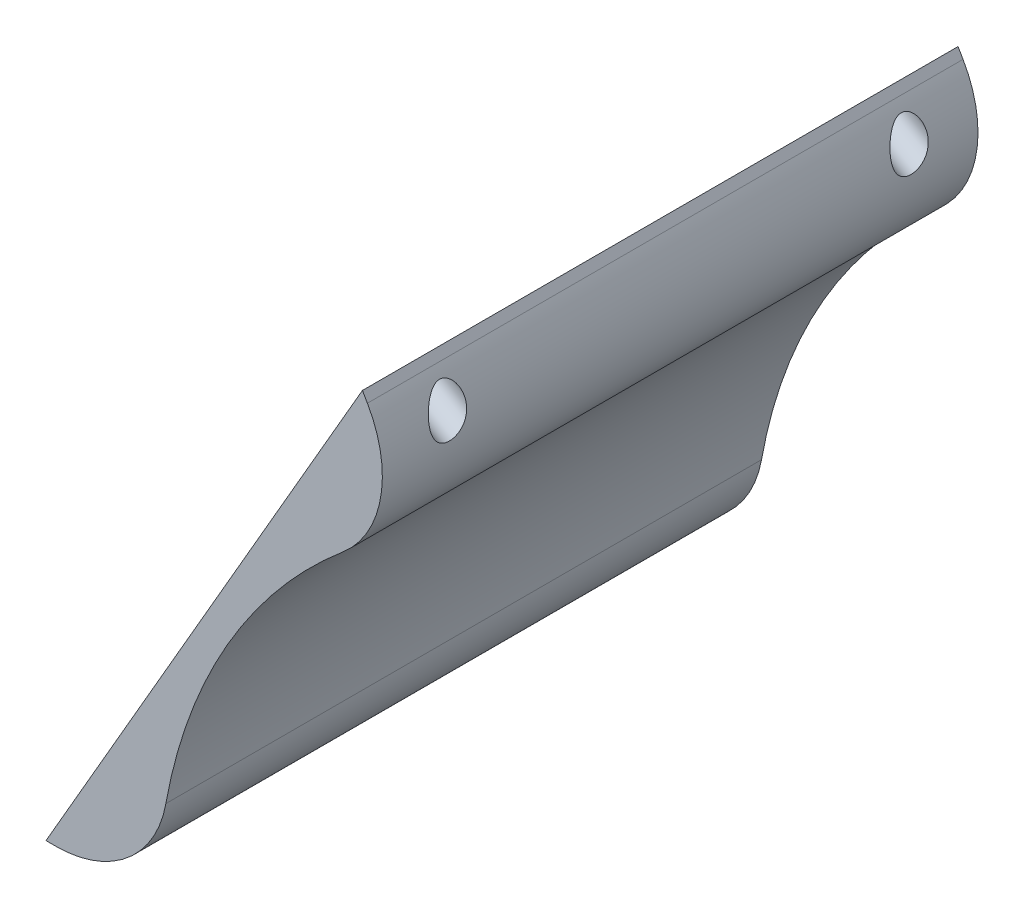
from build123d import *

# Parameters (mm, degrees)
BOSS_EXTRUDE1_DEPTH       = 80
FILLET1_R                 = 15
FILLET2_R                 = 15
SKETCH3_R                 = 2.5
CUT_EXTRUDE1_DEPTH        = 10
SKETCH3_2_R               = 2.5
BOSS_EXTRUDE2_DEPTH       = 1
SKETCH5_R                 = 1.5
CUT_EXTRUDE2_DEPTH        = 1
LPATTERN1_COUNT           = 2
LPATTERN1_PITCH           = 62
LPATTERN2_COUNT           = 2
LPATTERN2_PITCH           = 77
LPATTERN2_COPY_1_SKETCH_R = 2.5
LPATTERN2_COPY_1_DEPTH    = 10
LPATTERN2_COPY_2_SKETCH_R = 2.5
LPATTERN2_COPY_2_DEPTH    = 1
LPATTERN2_COPY_3_SKETCH_R = 1.5
LPATTERN2_COPY_3_DEPTH    = 1


with BuildPart() as part:
    # Sketch2 → Boss-Extrude1 (new body)
    with BuildSketch(Plane.XY):
        with BuildLine():
            Line((-70, 0), (-85, 0))
            Line((-85, 0), (-42.5, 73.612159322))
            Line((-42.5, 73.612159322), (-35, 60.621778265))
            ThreePointArc((-35, 60.621778265), (-60.621778265, 35), (-70, 0))
        make_face()
    extrude(amount=BOSS_EXTRUDE1_DEPTH)

    # Fillet1
    fillet1_edges = [part.edges().sort_by_distance(p)[0] for p in [
        (-70, 0, 40),
    ]]
    fillet(fillet1_edges, radius=FILLET1_R)

    # Fillet2
    fillet2_edges = [part.edges().sort_by_distance(p)[0] for p in [
        (-35, 60.621778265, 40),
    ]]
    fillet(fillet2_edges, radius=FILLET2_R)

    # Sketch3 → Cut-Extrude1 (cut)
    with BuildSketch(Plane(origin=(-63.75, 36.806079661, 0), x_dir=(0, 0, 1), z_dir=(-0.866025403784438, 0.5000000000000011, 0))):
        with Locations((9, 38.5)):
            Circle(SKETCH3_R)
    cut_extrude1 = extrude(amount=-CUT_EXTRUDE1_DEPTH, mode=Mode.SUBTRACT)

    # Sketch3<2> → Boss-Extrude2 (add)
    with BuildSketch(Plane(origin=(-63.75, 36.806079661, 0), x_dir=(0, 0, 1), z_dir=(-0.866025403784438, 0.5000000000000011, 0))):
        with Locations((9, 38.5)):
            Circle(SKETCH3_2_R)
    boss_extrude2 = extrude(amount=-BOSS_EXTRUDE2_DEPTH)

    # Sketch5 → Cut-Extrude2 (cut)
    with BuildSketch(Plane(origin=(-63.75, 36.806079661, 0), x_dir=(0, 0, 1), z_dir=(-0.866025403784438, 0.5000000000000011, 0))):
        with Locations((9, 38.5)):
            Circle(SKETCH5_R)
    cut_extrude2 = extrude(amount=-CUT_EXTRUDE2_DEPTH, mode=Mode.SUBTRACT)

    # LPattern1: Cut-Extrude1, Boss-Extrude2, Cut-Extrude2 ×2
    with Locations(*[(0, 0, i * LPATTERN1_PITCH) for i in range(1, LPATTERN1_COUNT)]):
        add(cut_extrude1, mode=Mode.SUBTRACT)
        add(boss_extrude2)
        add(cut_extrude2, mode=Mode.SUBTRACT)

    # LPattern2: Cut-Extrude1, Boss-Extrude2, Cut-Extrude2 ×2
    with Locations(*[Vector(-0.500000000000001, -0.866025403784438, 0) * (i * LPATTERN2_PITCH) for i in range(1, LPATTERN2_COUNT)]):
        add(cut_extrude1, mode=Mode.SUBTRACT)
        add(boss_extrude2)
        add(cut_extrude2, mode=Mode.SUBTRACT)

    # LPattern2 copy 1 sketch → LPattern2 copy 1 (cut)
    with BuildSketch(Plane(origin=(-102.25, -29.877876431, 62), x_dir=(0, 0, 1), z_dir=(-0.866025403784438, 0.5000000000000011, 0))):
        with Locations((9, 38.5)):
            Circle(LPATTERN2_COPY_1_SKETCH_R)
    extrude(amount=-LPATTERN2_COPY_1_DEPTH, mode=Mode.SUBTRACT)

    # LPattern2 copy 2 sketch → LPattern2 copy 2 (add)
    with BuildSketch(Plane(origin=(-102.25, -29.877876431, 62), x_dir=(0, 0, 1), z_dir=(-0.866025403784438, 0.5000000000000011, 0))):
        with Locations((9, 38.5)):
            Circle(LPATTERN2_COPY_2_SKETCH_R)
    extrude(amount=-LPATTERN2_COPY_2_DEPTH)

    # LPattern2 copy 3 sketch → LPattern2 copy 3 (cut)
    with BuildSketch(Plane(origin=(-102.25, -29.877876431, 62), x_dir=(0, 0, 1), z_dir=(-0.866025403784438, 0.5000000000000011, 0))):
        with Locations((9, 38.5)):
            Circle(LPATTERN2_COPY_3_SKETCH_R)
    extrude(amount=-LPATTERN2_COPY_3_DEPTH, mode=Mode.SUBTRACT)


solid = part.part
